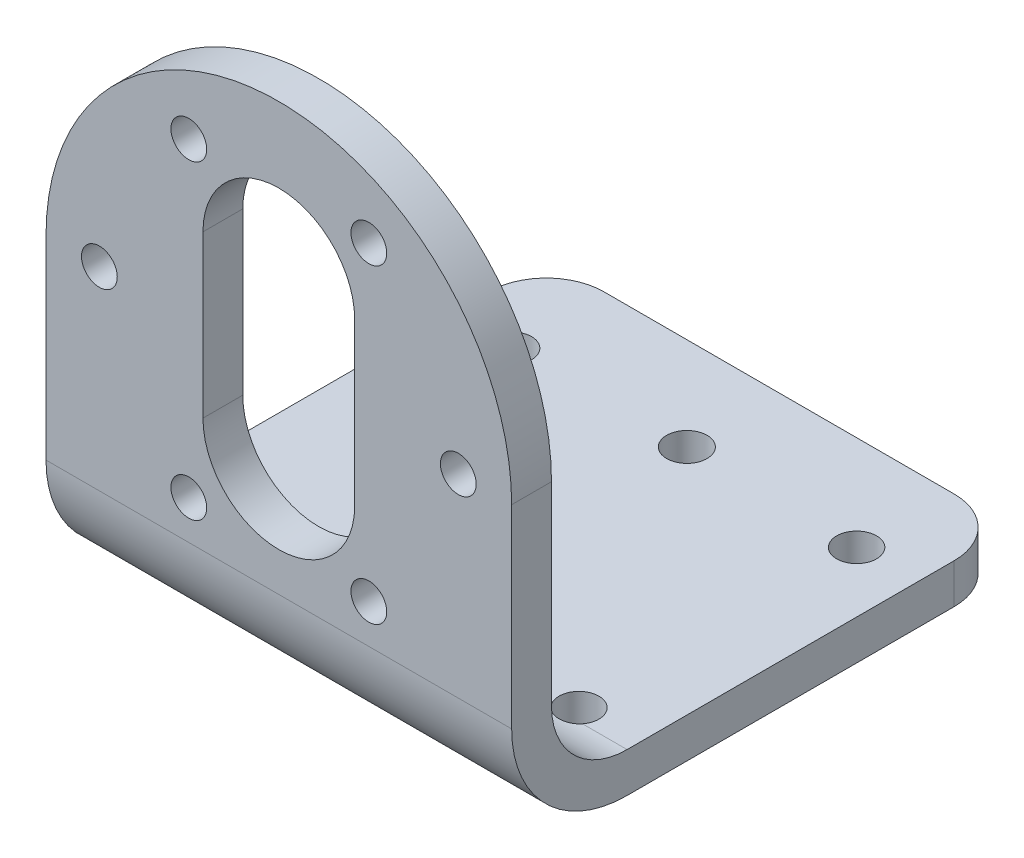
from build123d import *

# Parameters (mm, degrees)
SKETCH1_W               = 40.35
SKETCH1_H               = 43.35
BOSS_EXTRUDE1_DEPTH     = 47
CUT_EXTRUDE2_DEPTH      = 102
FILLET1_R               = 10
CUT_EXTRUDE3_DEPTH      = 102
FILLET2_R               = 5
CUT_EXTRUDE4_DEPTH      = 102
CUT_EXTRUDE4_DEPTH_BACK = 102
SKETCH6_R               = 1.73
CUT_EXTRUDE5_DEPTH      = 102
SKETCH8_R               = 1.55
CUT_EXTRUDE6_DEPTH      = 102
SKETCH9_R               = 1.75
CUT_EXTRUDE7_DEPTH      = 10


with BuildPart() as part:
    # Sketch1 → Boss-Extrude1 (new body)
    with BuildSketch(Plane(origin=(0, 0, 0), x_dir=(1, 0, 0), z_dir=(0, 1, 0))):
        with Locations((-26.966212793, -29.108023223)):
            Rectangle(SKETCH1_W, SKETCH1_H)
    extrude(amount=BOSS_EXTRUDE1_DEPTH)

    # Sketch3 → Cut-Extrude2 (cut)
    with BuildSketch(Plane.XY.offset(50.783023223)):
        with BuildLine():
            Line((-6.791212793, 47), (-26.966212793, 47))
            ThreePointArc((-26.966212793, 47), (-12.700333482, 41.09087931), (-6.791212793, 26.825))
            Line((-6.791212793, 26.825), (-6.791212793, 47))
        make_face()
        with BuildLine():
            Line((-47.141212793, 47), (-47.141212793, 26.825))
            ThreePointArc((-47.141212793, 26.825), (-41.232092103, 41.09087931), (-26.966212793, 47))
            Line((-26.966212793, 47), (-47.141212793, 47))
        make_face()
    extrude(amount=-CUT_EXTRUDE2_DEPTH, mode=Mode.SUBTRACT)

    # Fillet1
    fillet1_edges = [part.edges().sort_by_distance(p)[0] for p in [
        (-26.966212793, 0, 50.783023223),
    ]]
    fillet(fillet1_edges, radius=FILLET1_R)

    # Sketch5 → Cut-Extrude3 (cut)
    with BuildSketch(Plane.ZY.offset(47.141212793)):
        with BuildLine():
            Line((47.333023223, 59.778436909), (-6.665763497, 59.778436909))
            Line((-6.665763497, 59.778436909), (-6.665763497, 3.45))
            Line((-6.665763497, 3.45), (40.783023223, 3.45))
            ThreePointArc((40.783023223, 3.45), (45.41457264, 5.368450583), (47.333023223, 10))
            Line((47.333023223, 10), (47.333023223, 59.778436909))
        make_face()
    extrude(amount=-CUT_EXTRUDE3_DEPTH, mode=Mode.SUBTRACT)

    # Fillet2
    fillet2_edges = [part.edges().sort_by_distance(p)[0] for p in [
        (-6.791212793, 1.725, 7.433023223),
        (-47.141212793, 1.725, 7.433023223),
    ]]
    fillet(fillet2_edges, radius=FILLET2_R)

    # Sketch6 → Cut-Extrude4 (cut, two sides: drawn at the far end of the back side and taken through both)
    with BuildSketch(Plane(origin=(0, 3.45, 0), x_dir=(1, 0, 0), z_dir=(0, 1, 0)).offset(-CUT_EXTRUDE4_DEPTH_BACK)):
        with Locations((-41.911212793, -15.663023223)):
            Circle(SKETCH6_R)
        with Locations((-41.911212793, -39.723023223)):
            Circle(SKETCH6_R)
        with Locations((-12.021212793, -15.663023223)):
            Circle(SKETCH6_R)
        with Locations((-12.021212793, -39.723023223)):
            Circle(SKETCH6_R)
    extrude(amount=CUT_EXTRUDE4_DEPTH + CUT_EXTRUDE4_DEPTH_BACK, mode=Mode.SUBTRACT)

    # Sketch7 → Cut-Extrude5 (cut)
    with BuildSketch(Plane.XY.offset(50.783023223)):
        with BuildLine():
            ThreePointArc((-26.966212793, 40.5), (-31.615439879, 38.574227086), (-33.541212793, 33.925))
            Line((-33.541212793, 33.925), (-33.541212793, 21.982917389))
            Line((-33.541212793, 21.982917389), (-33.541212793, 19.945))
            ThreePointArc((-33.541212793, 19.945), (-26.966212793, 13.37), (-20.391212793, 19.945))
            Line((-20.391212793, 19.945), (-20.391212793, 20.41689663))
            Line((-20.391212793, 20.41689663), (-20.391212793, 33.925))
            ThreePointArc((-20.391212793, 33.925), (-22.316985706, 38.574227086), (-26.966212793, 40.5))
        make_face()
    extrude(amount=-CUT_EXTRUDE5_DEPTH, mode=Mode.SUBTRACT)

    # Sketch8 → Cut-Extrude6 (cut)
    with BuildSketch(Plane.XY.offset(50.783023223)):
        with Locations((-42.516212793, 26.825)):
            Circle(SKETCH8_R)
        with Locations((-34.766212793, 40.277230298)):
            Circle(SKETCH8_R)
        with Locations((-34.766212793, 13.372769702)):
            Circle(SKETCH8_R)
        with Locations((-19.166212793, 13.372769702)):
            Circle(SKETCH8_R)
        with Locations((-11.416212793, 26.825)):
            Circle(SKETCH8_R)
        with Locations((-19.166212793, 40.277230298)):
            Circle(SKETCH8_R)
    extrude(amount=-CUT_EXTRUDE6_DEPTH, mode=Mode.SUBTRACT)

    # Sketch9 → Cut-Extrude7 (cut)
    with BuildSketch(Plane.XZ):
        with Locations((-26.911212793, 15.483023223)):
            Circle(SKETCH9_R)
    extrude(amount=-CUT_EXTRUDE7_DEPTH, mode=Mode.SUBTRACT)


solid = part.part
